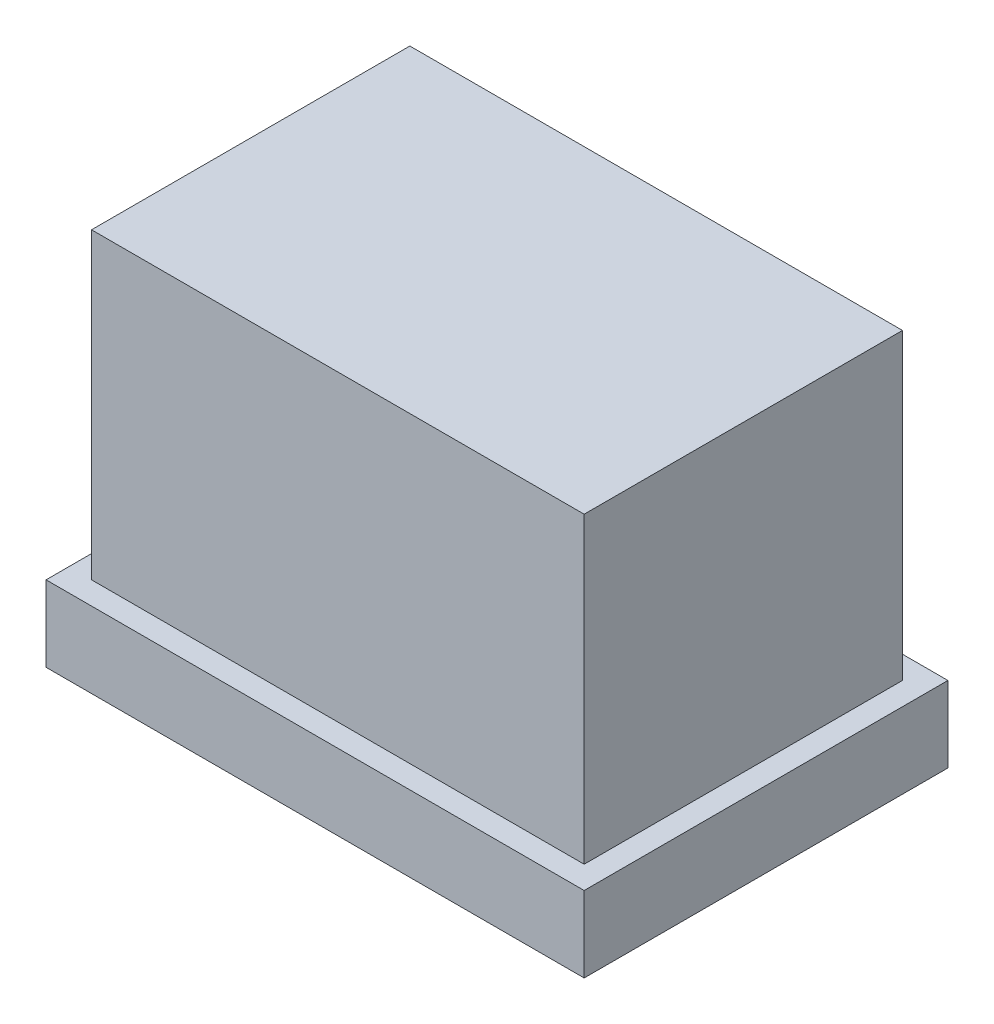
from build123d import *

# Parameters (mm, degrees)
SKETCH_1_W      = 13
SKETCH_1_H      = 8.4
EXTRUDE_1_DEPTH = 8
SKETCH_1_3_W    = 14.2
SKETCH_1_3_H    = 9.6
EXTRUDE_2_DEPTH = 2


with BuildPart() as part:
    # 草图1 → 凸台-拉伸1 (new body)
    with BuildSketch(Plane(origin=(0, 0, 0), x_dir=(1, 0, 0), z_dir=(0, 1, 0))):
        with Locations((6.5, 4.2)):
            Rectangle(SKETCH_1_W, SKETCH_1_H)
    extrude(amount=EXTRUDE_1_DEPTH)


with BuildPart() as body_2:
    # 草图1<3> → 凸台-拉伸2 (new body)
    with BuildSketch(Plane(origin=(0, 0, 0), x_dir=(1, 0, 0), z_dir=(0, 1, 0))):
        with Locations((6.5, 4.2)):
            Rectangle(SKETCH_1_3_W, SKETCH_1_3_H)
    extrude(amount=-EXTRUDE_2_DEPTH)


solid = Compound([part.part, body_2.part])
